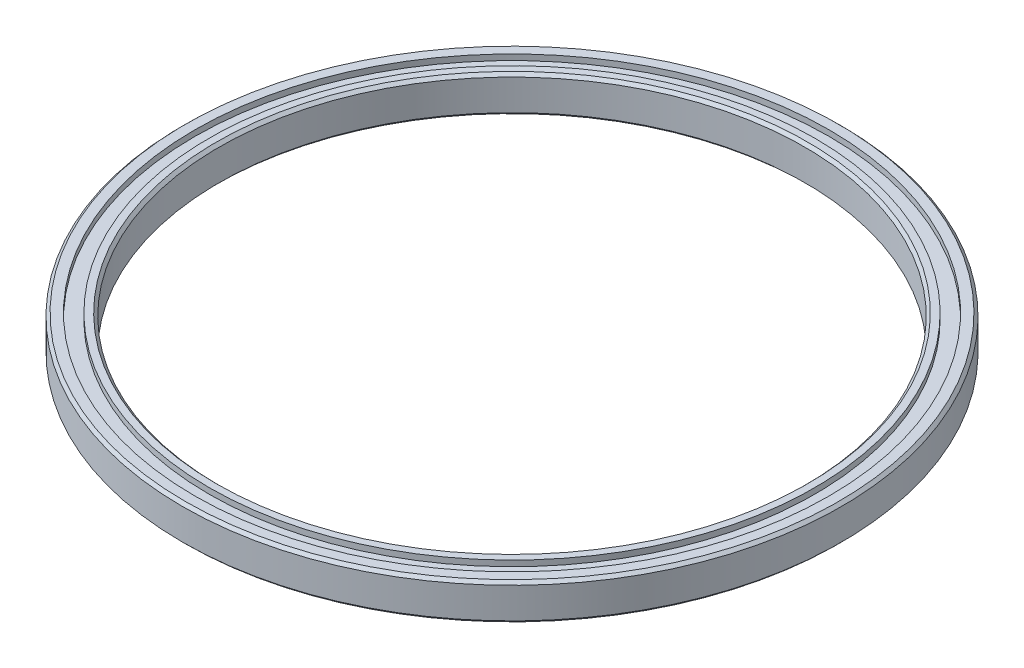
from build123d import *

# Parameters (mm, degrees)
SKETCH_1_R          = 57.15
SKETCH_1_R_2        = 50.8
EXTRUDE_1_DEPTH     = 6.35
SKETCH_2_R          = 55
SKETCH_2_R_2        = 52.5
CUT_EXTRUDE_1_DEPTH = 1
CUT_EXTRUDE_START   = -1
SKETCH_3_R          = 55
SKETCH_3_R_2        = 52.5
CUT_EXTRUDE_2_DEPTH = 1
CHAMFER_1_SIZE      = 0.5


with BuildPart() as part:
    # 草图1 → 凸台-拉伸1 (new body)
    with BuildSketch(Plane(origin=(0, 0, 0), x_dir=(1, 0, 0), z_dir=(0, 1, 0))):
        with Locations(Location((0, 0, 0), (0, 0, 270))):
            Circle(SKETCH_1_R)
        with Locations(Location((0, 0, 0), (0, 0, 270))):
            Circle(SKETCH_1_R_2, mode=Mode.SUBTRACT)
    extrude(amount=EXTRUDE_1_DEPTH)

    # 草图2 → 切除-拉伸1 (cut)
    with BuildSketch(Plane(origin=(0, 6.35, 0), x_dir=(1, 0, 0), z_dir=(0, 1, 0))):
        with Locations(Location((0, 0, 0), (0, 0, 270))):
            Circle(SKETCH_2_R)
        with Locations(Location((0, 0, 0), (0, 0, 270))):
            Circle(SKETCH_2_R_2, mode=Mode.SUBTRACT)
    extrude(amount=-CUT_EXTRUDE_1_DEPTH, mode=Mode.SUBTRACT)

    # 草图3 → 切除-拉伸2 (cut)
    with BuildSketch(Plane.XZ.offset(CUT_EXTRUDE_START)):
        with Locations(Location((0, 0, 0), (0, 0, 90))):
            Circle(SKETCH_3_R)
        with Locations(Location((0, 0, 0), (0, 0, 90))):
            Circle(SKETCH_3_R_2, mode=Mode.SUBTRACT)
    extrude(amount=CUT_EXTRUDE_2_DEPTH, mode=Mode.SUBTRACT)

    # 倒角1
    chamfer_1_edges = [part.edges().sort_by_distance(p)[0] for p in [
        (0, 0, -57.15),
        (0, 6.35, -57.15),
        (0, 0, -50.8),
        (0, 6.35, -50.8),
    ]]
    chamfer(chamfer_1_edges, length=CHAMFER_1_SIZE)


solid = part.part
